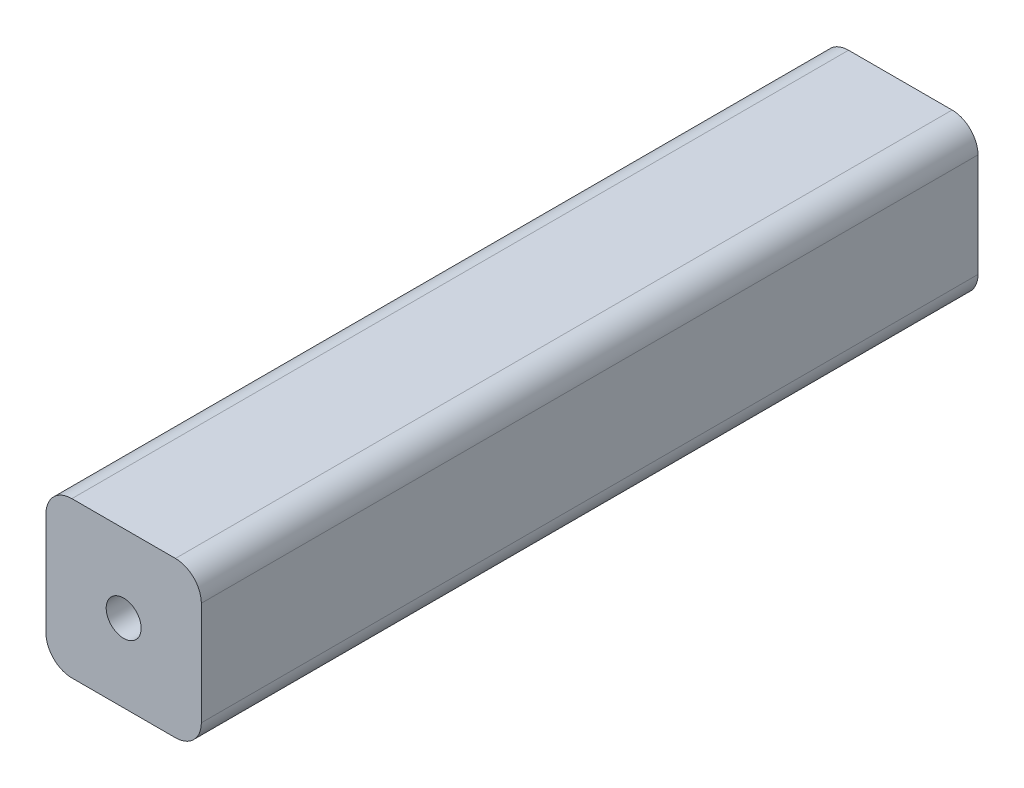
from build123d import *

# Parameters (mm, degrees)
SKETCH1_R           = 1.35
BOSS_EXTRUDE1_DEPTH = 60


with BuildPart() as part:
    # Sketch1 → Boss-Extrude1 (new body)
    with BuildSketch(Plane.XY):
        with BuildLine():
            Line((-83, -75.5), (-75, -75.5))
            ThreePointArc((-75, -75.5), (-73.585786438, -76.085786438), (-73, -77.5))
            Line((-73, -77.5), (-73, -85.5))
            ThreePointArc((-73, -85.5), (-73.585786438, -86.914213562), (-75, -87.5))
            Line((-75, -87.5), (-83, -87.5))
            ThreePointArc((-83, -87.5), (-84.414213562, -86.914213562), (-85, -85.5))
            Line((-85, -85.5), (-85, -77.5))
            ThreePointArc((-85, -77.5), (-84.414213562, -76.085786438), (-83, -75.5))
        make_face()
        with Locations((-79, -81.5)):
            Circle(SKETCH1_R, mode=Mode.SUBTRACT)
    extrude(amount=BOSS_EXTRUDE1_DEPTH)


solid = part.part
